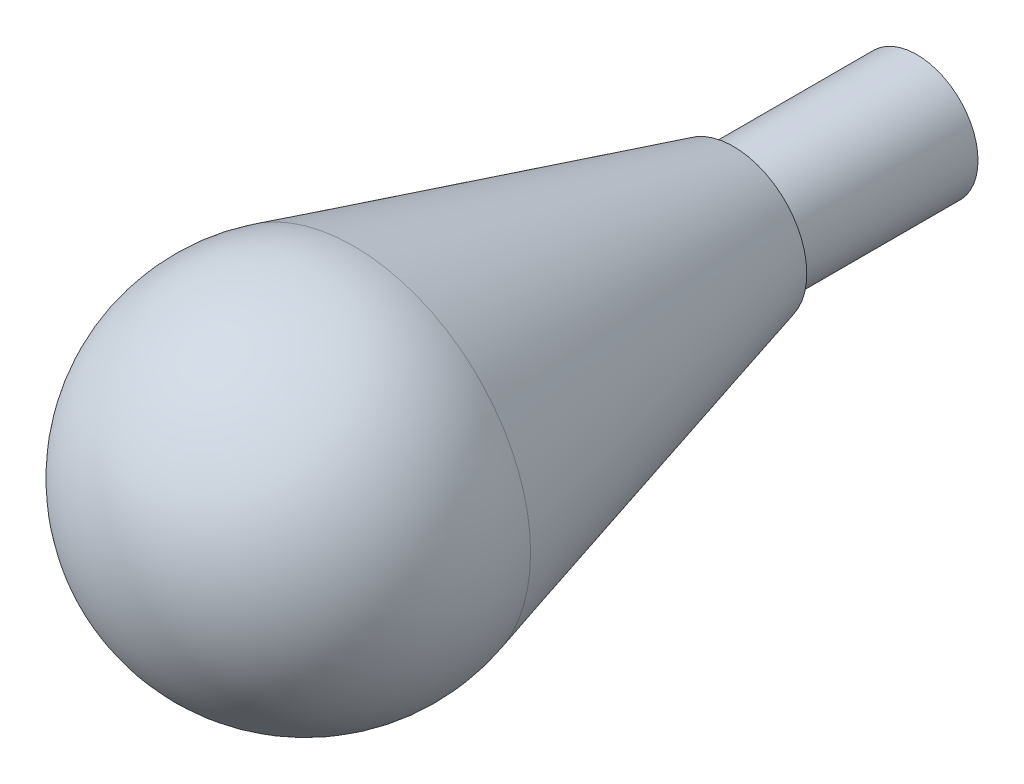
from build123d import *

# Parameters (mm, degrees)
SKETCH1_R           = 5
BOSS_EXTRUDE1_DEPTH = 15


with BuildPart() as part:
    # Sketch1 → Boss-Extrude1 (new body)
    with BuildSketch(Plane(origin=(-0.629991872, -7.961861068, 0), x_dir=(1, 0, 0), z_dir=(0, 0, 1))):
        with Locations((0.629991872, 7.961861068)):
            Circle(SKETCH1_R)
    extrude(amount=BOSS_EXTRUDE1_DEPTH)

    # Sketch2 → Revolve2 (revolve)
    with BuildSketch(Plane(origin=(0, 0, 0), x_dir=(0, 0, -1), z_dir=(1, 0, 0))):
        with BuildLine():
            Line((-65, 0), (-15, 0))
            Line((-15, 0), (-15, 6))
            Line((-15, 6), (-46.052201308, 14.471174295))
            ThreePointArc((-46.052201308, 14.471174295), (-59.104477459, 11.920926566), (-65, 0))
        make_face()
    revolve(axis=Axis((0, 0, 65), (0, 0, -1)))


solid = part.part
